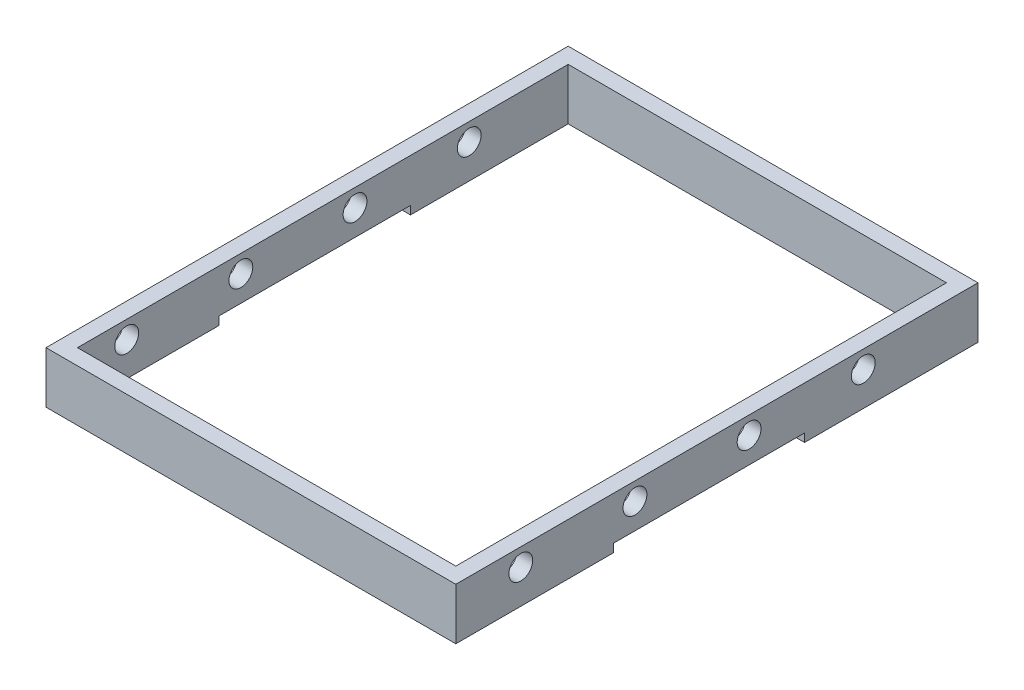
from build123d import *

# Parameters (mm, degrees)
SKETCH1_W           = 104.1
SKETCH1_H           = 132.64
SKETCH1_W_2         = 96.1
SKETCH1_H_2         = 124.64
BOSS_EXTRUDE1_DEPTH = 11
SKETCH3_R           = 3.025
CUT_EXTRUDE1_DEPTH  = 124.919943512
LPATTERN1_COUNT     = 4
LPATTERN1_PITCH     = 29
BOSS_EXTRUDE2_DEPTH = 2.1


with BuildPart() as part:
    # Sketch1 → Boss-Extrude1 (new body)
    with BuildSketch(Plane(origin=(0, 0, 0), x_dir=(1, 0, 0), z_dir=(0, 1, 0))):
        Rectangle(SKETCH1_W, SKETCH1_H)
        Rectangle(SKETCH1_W_2, SKETCH1_H_2, mode=Mode.SUBTRACT)
    extrude(amount=BOSS_EXTRUDE1_DEPTH)

    # Sketch3 → Cut-Extrude1 (cut, through all)
    with BuildSketch(Plane(origin=(52.05, 0, 0), x_dir=(0, 0, -1), z_dir=(1, 0, 0))):
        with Locations((-49.82, 6.5)):
            Circle(SKETCH3_R)
    cut_extrude1 = extrude(amount=-CUT_EXTRUDE1_DEPTH, mode=Mode.SUBTRACT)

    # LPattern1: Cut-Extrude1 ×4
    with Locations(*[(0, 0, -i * LPATTERN1_PITCH) for i in range(1, LPATTERN1_COUNT)]):
        add(cut_extrude1, mode=Mode.SUBTRACT)

    # Sketch5 → Boss-Extrude2 (add)
    with BuildSketch(Plane.XZ):
        Polygon((48.05, 62.32), (48.05, 26.32), (52.05, 26.32), (52.05, 66.32), (-52.05, 66.32), (-52.05, 26.32), (-48.05, 26.32), (-48.05, 62.32), align=None)
        Polygon((-48.05, -22.26), (-52.05, -22.26), (-52.05, -66.32), (52.05, -66.32), (52.05, -22.26), (48.05, -22.26), (48.05, -62.32), (-48.05, -62.32), align=None)
    extrude(amount=BOSS_EXTRUDE2_DEPTH)


solid = part.part
